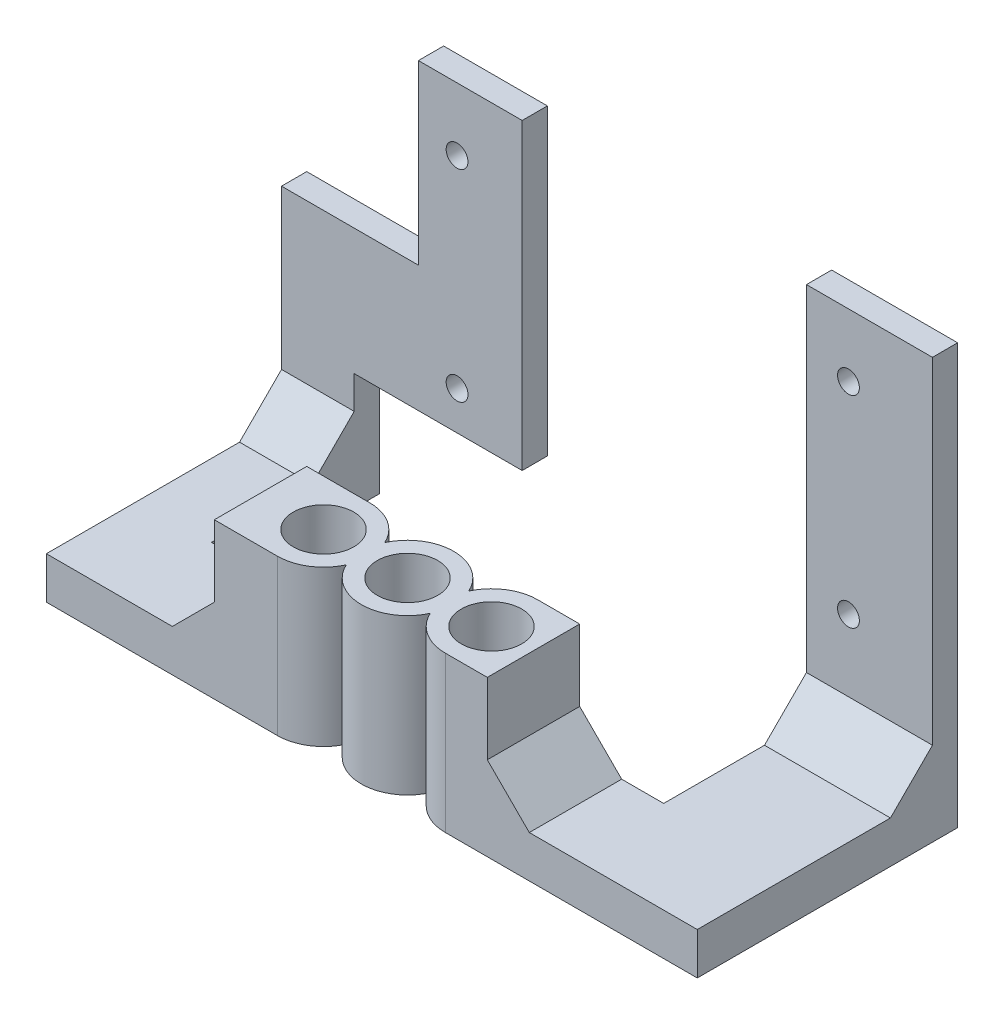
from build123d import *

# Parameters (mm, degrees)
BOSS_EXTRUDE1_REACH      = 42.407
BOSS_EXTRUDE1_END_RADIUS = 5.5
SKETCH3_W                = 11
SKETCH3_H                = 18.5
SKETCH4_W                = 15
SKETCH4_H                = 50
BOSS_EXTRUDE2_DEPTH      = 20
SKETCH6_W                = 29.427394299
SKETCH6_H                = 67.669990189
CUT_EXTRUDE1_DEPTH       = 25
SKETCH5_R                = 1.3
CUT_EXTRUDE3_DEPTH       = 10
LPATTERN3_COUNT          = 3
LPATTERN3_PITCH          = 10
BOSS_EXTRUDE3_REACH      = 82.352
BOSS_EXTRUDE3_END_RADIUS = 5.5
SKETCH8_W                = 11
SKETCH8_H                = 18.5
SKETCH10_W               = 11
SKETCH10_H               = 5
BOSS_EXTRUDE4_DEPTH      = 20
SKETCH11_W               = 8.652195312
SKETCH11_H               = 5
BOSS_EXTRUDE5_DEPTH      = 20
BOSS_EXTRUDE6_DEPTH      = 20
BOSS_EXTRUDE6_DEPTH_BACK = 8.652195
SKETCH12_W               = 3
SKETCH12_H               = 50
SKETCH14_W               = 20
SKETCH14_H               = 13.9
SKETCH14_W_2             = 16.3
SKETCH14_H_2             = 21.1
CUT_EXTRUDE5_DEPTH       = 10
CHAMFER2_SIZE            = 5


with BuildPart() as part:
    # Sketch1 → Revolve1 (revolve)
    with BuildSketch(Plane.XY, mode=Mode.PRIVATE) as revolve1_sk:
        Polygon((3.6, 18.5), (5.5, 18.5), (5.5, 0), (0.5, 0), (0.5, 1), (1.2, 1), (1.2, 6), (3.6, 6), align=None)
    revolve1 = revolve(revolve1_sk.sketch.rotate(Axis((0, 0, 0), (0, 1, 0)), 90), axis=Axis((0, 0, 0), (0, 1, 0)))

    # Boss-Extrude1: up to this cylinder (the profile starts outside it)
    boss_extrude1_end = Plane(origin=(0, 9.25, 0), z_dir=(0, -1, 0)) * Cylinder(BOSS_EXTRUDE1_END_RADIUS, 96.814, mode=Mode.PRIVATE)
    # Sketch3 → Boss-Extrude1 (add, up to the surface)
    with BuildSketch(Plane(origin=(30, 0, 0), x_dir=(0, 0, -1), z_dir=(1, 0, 0)), mode=Mode.PRIVATE) as boss_extrude1_sk1:
        with Locations((0, 9.25)):
            Rectangle(SKETCH3_W, SKETCH3_H)
    boss_extrude1_tool1 = extrude(boss_extrude1_sk1.sketch, amount=-BOSS_EXTRUDE1_REACH, mode=Mode.PRIVATE) - boss_extrude1_end
    add(boss_extrude1_tool1.solids().sort_by_distance((30, 9.25, 0))[0])

    # Sketch4 → Boss-Extrude2 (add)
    with BuildSketch(Plane(origin=(0, 0, -5.5), x_dir=(-1, 0, 0), z_dir=(0, 0, -1))):
        with Locations((-22.5, 25)):
            Rectangle(SKETCH4_W, SKETCH4_H)
    extrude(amount=BOSS_EXTRUDE2_DEPTH)

    # Sketch6 → Cut-Extrude1 (cut)
    with BuildSketch(Plane(origin=(30, 0, 0), x_dir=(0, 0, -1), z_dir=(1, 0, 0))):
        with Locations((7.786302851, 38.834995095)):
            Rectangle(SKETCH6_W, SKETCH6_H)
    extrude(amount=-CUT_EXTRUDE1_DEPTH, mode=Mode.SUBTRACT)

    # Sketch5 → Cut-Extrude3 (cut)
    with BuildSketch(Plane(origin=(0, 0, -25.5), x_dir=(-1, 0, 0), z_dir=(0, 0, -1))):
        with Locations((-20, 42.5)):
            Circle(SKETCH5_R)
        with Locations((-20, 18.5)):
            Circle(SKETCH5_R)
    cut_extrude3 = extrude(amount=-CUT_EXTRUDE3_DEPTH, mode=Mode.SUBTRACT)

    # LPattern3: Revolve1 ×3
    with Locations(*[(-i * LPATTERN3_PITCH, 0, 0) for i in range(1, LPATTERN3_COUNT)]):
        add(revolve1)

    # Boss-Extrude3: up to this cylinder (the profile starts outside it)
    boss_extrude3_end = Plane(origin=(-20, 9.25, 0), z_dir=(0, -1, 0)) * Cylinder(BOSS_EXTRUDE3_END_RADIUS, 176.704, mode=Mode.PRIVATE)
    # Sketch8 → Boss-Extrude3 (add, up to the surface)
    with BuildSketch(Plane(origin=(-27.5, 0, 0), x_dir=(0, 0, -1), z_dir=(1, 0, 0)), mode=Mode.PRIVATE) as boss_extrude3_sk1:
        with Locations((0, 9.25)):
            Rectangle(SKETCH8_W, SKETCH8_H)
    boss_extrude3_tool1 = extrude(boss_extrude3_sk1.sketch, amount=BOSS_EXTRUDE3_REACH, mode=Mode.PRIVATE) - boss_extrude3_end
    add(boss_extrude3_tool1.solids().sort_by_distance((-27.5, 9.25, 0))[0])

    # Sketch10 → Boss-Extrude4 (add)
    with BuildSketch(Plane.ZY.offset(27.5)):
        with Locations((0, 2.5)):
            Rectangle(SKETCH10_W, SKETCH10_H)
    extrude(amount=BOSS_EXTRUDE4_DEPTH)

    # Sketch11 → Boss-Extrude5 (add)
    with BuildSketch(Plane(origin=(0, 0, -5.5), x_dir=(-1, 0, 0), z_dir=(0, 0, -1))):
        with Locations((43.173902344, 2.5)):
            Rectangle(SKETCH11_W, SKETCH11_H)
    extrude(amount=BOSS_EXTRUDE5_DEPTH)

    # Sketch12 → Boss-Extrude6 (add, two sides: drawn at the far end of the back side and taken through both)
    with BuildSketch(Plane(origin=(-38.847804688, 0, 0), x_dir=(0, 0, -1), z_dir=(1, 0, 0)).offset(-BOSS_EXTRUDE6_DEPTH_BACK)):
        with Locations((24, 25)):
            Rectangle(SKETCH12_W, SKETCH12_H)
    extrude(amount=BOSS_EXTRUDE6_DEPTH + BOSS_EXTRUDE6_DEPTH_BACK)

    # Mirror1: Cut-Extrude3 across plane
    add(cut_extrude3.mirror(Plane.ZY.offset(3.3)), mode=Mode.SUBTRACT)

    # Sketch14 → Cut-Extrude5 (cut)
    with BuildSketch(Plane.XY.offset(-22.5)):
        with Locations((-28.847804688, 6.95)):
            Rectangle(SKETCH14_W, SKETCH14_H)
        with Locations((-39.35, 39.45)):
            Rectangle(SKETCH14_W_2, SKETCH14_H_2)
    extrude(amount=-CUT_EXTRUDE5_DEPTH, mode=Mode.SUBTRACT)

    # Chamfer2
    chamfer2_edges = [part.edges().sort_by_distance(p)[0] for p in [
        (-27.5, 5, 0),
        (-43.173902188, 5, -22.5),
        (5, 5, 0),
        (22.5, 5, -22.5),
    ]]
    chamfer(chamfer2_edges, length=CHAMFER2_SIZE)


solid = part.part
